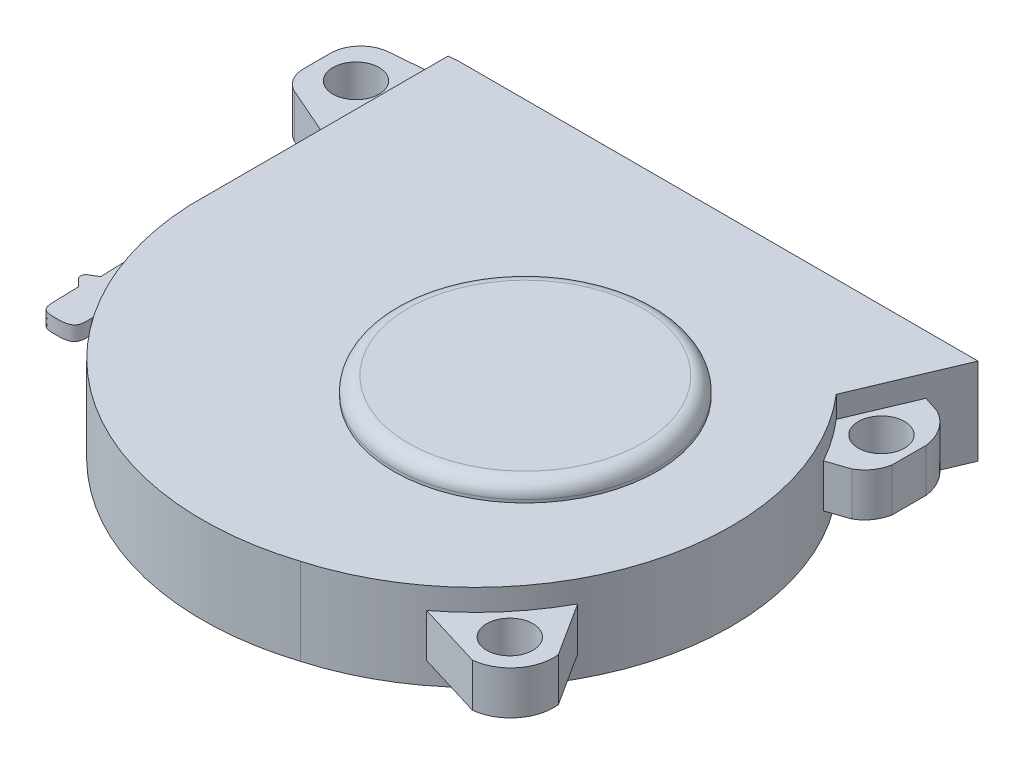
from build123d import *
from build123d.topology import SkipClean

# Parameters (mm, degrees)
SKETCH2_R           = 1.5
BOSS_EXTRUDE1_DEPTH = 3
SKETCH3_R           = 9.096048505
BOSS_EXTRUDE2_DEPTH = 1.2
FILLET1_R           = 1
CUT_EXTRUDE1_DEPTH  = 1.5
CUT_EXTRUDE2_START  = -1.5
CUT_EXTRUDE2_DEPTH  = 1.5
CUT_EXTRUDE3_DEPTH  = 5
MOVE_FACE1_BY       = 0.1
MOVE_FACE1_2_BY     = 0.1
MOVE_FACE1_3_BY     = 0.1


with BuildPart() as part:
    # Sketch2 → Boss-Extrude1 (new, symmetric)
    with BuildSketch(Plane(origin=(0, 0, 0), x_dir=(1, 0, 0), z_dir=(0, 1, 0))):
        with BuildLine():
            Line((-20.599560655, -3.593123858), (-21.028912901, -3.379903546))
            Line((-21.028912901, -3.379903546), (-21.254187526, 1.993220784))
            add(Edge.make_bspline(
                [(-21.254187526, 1.993220784), (-21.250081776, 2.377226096), (-21.195139063, 3.186038357), (-20.237966675, 3.678013728), (-19.626306607, 3.674971934), (-19.293061526, 3.554683236)],
                knots=[0.008573336, 0.008573336, 0.008573336, 0.008573336, 0.425411643, 0.645508579, 0.988655727, 0.988655727, 0.988655727, 0.988655727], degree=3))
            Line((-19.293061526, 3.554683236), (-19.293061526, -0.935875279))
            ThreePointArc((-19.293061526, -0.935875279), (-11.01478007, -15.867347151), (5.868677769, -18.402627716))
            ThreePointArc((5.868677769, -18.402627716), (8.914480471, -17.213611271), (11.689585214, -15.484603502))
            Line((11.689585214, -15.484603502), (16.248961374, -16.876941699))
            ThreePointArc((16.248961374, -16.876941699), (18.257558766, -15.774505508), (18.891422269, -13.572677609))
            Line((18.891422269, -13.572677609), (16.51986009, -9.867884272))
            ThreePointArc((16.51986009, -9.867884272), (18.681381592, -1.319406436), (16.449996012, 7.211101574))
            Line((16.449996012, 7.211101574), (17.928084104, 7.713187831))
            ThreePointArc((17.928084104, 7.713187831), (18.677006581, 8.400562387), (19.066466062, 9.339545863))
            Line((19.066466062, 9.339545863), (19.069212644, 11.701301235))
            ThreePointArc((19.069212644, 11.701301235), (18.53112158, 13.108816633), (17.413375201, 14.119402908))
            Line((17.413375201, 14.119402908), (16.248961374, 14.508827059))
            Line((16.248961374, 14.508827059), (17.314988377, 17.040275234))
            Line((17.314988377, 17.040275234), (-18.629227908, 17.040275234))
            Line((-18.629227908, 17.040275234), (-23.111573489, 16.669208858))
            ThreePointArc((-23.111573489, 16.669208858), (-24.534989581, 15.930034001), (-25.030823978, 14.404700893))
            Line((-25.030823978, 14.404700893), (-25.030823978, 12.70560175))
            ThreePointArc((-25.030823978, 12.70560175), (-24.756748057, 11.739888101), (-24.016241086, 11.062119787))
            Line((-24.016241086, 11.062119787), (-19.293061526, 9.00102042))
            Line((-19.293061526, 9.00102042), (-19.293061526, 5.839179653))
            Line((-19.293061526, 5.839179653), (-22.090684207, 5.839179653))
            ThreePointArc((-22.090684207, 5.839179653), (-22.935760928, 5.565442119), (-23.357392581, 4.783576625))
            Line((-23.357392581, 4.783576625), (-23.096619876, -3.253456456))
            Line((-23.096619876, -3.253456456), (-23.621531964, -3.576891157))
            ThreePointArc((-23.621531964, -3.576891157), (-23.831523214, -3.884927944), (-23.671952518, -4.221855504))
            Line((-23.671952518, -4.221855504), (-23.25143386, -4.644287186))
            Line((-23.25143386, -4.644287186), (-23.202937263, -6.523606801))
            add(Edge.make_bspline(
                [(-23.202937263, -6.523606801), (-23.190415125, -6.701394879), (-23.14585211, -7.158039831), (-22.604610265, -7.291644066), (-22.131088375, -7.301130698), (-21.611573501, -7.301182592), (-20.850084131, -7.060004854), (-20.915185829, -6.352757768), (-20.915665013, -6.081028816)],
                knots=[0, 0, 0, 0, 0.172348306, 0.293808545, 0.415161147, 0.571057182, 0.730620463, 1, 1, 1, 1], degree=3))
            Line((-20.915665013, -6.081028816), (-20.979073646, -4.568641575))
            Line((-20.979073646, -4.568641575), (-20.599560655, -4.155522335))
            ThreePointArc((-20.599560655, -4.155522335), (-20.467265038, -3.874323097), (-20.599560655, -3.593123858))
        make_face()
        with Locations(Location((16.153998691, -14.195749789, 0), (0, 0, 270))):
            Circle(SKETCH2_R, mode=Mode.SUBTRACT)
        with Locations(Location((-22.494848615, 13.810394624, 0), (0, 0, 270))):
            Circle(SKETCH2_R, mode=Mode.SUBTRACT)
        with Locations(Location((16.894563054, 10.777137226, 0), (0, 0, 270))):
            Circle(SKETCH2_R, mode=Mode.SUBTRACT)
    extrude(amount=BOSS_EXTRUDE1_DEPTH, both=True)

    # Sketch3 → Boss-Extrude2 (add)
    with BuildSketch(Plane(origin=(0, 3, 0), x_dir=(1, 0, 0), z_dir=(0, 1, 0))):
        with Locations(Location((3.73137128, -0.69899531, 0), (0, 0, 270))):
            Circle(SKETCH3_R)
    extrude(amount=BOSS_EXTRUDE2_DEPTH)

    # Fillet1
    fillet1_edges = [part.edges().sort_by_distance(p)[0] for p in [
        (3.73137128, 4.2, -8.397053195),
    ]]
    fillet(fillet1_edges, radius=FILLET1_R)

    # Sketch4 → Cut-Extrude1 (cut)
    with SkipClean():  # the faces are left unmerged after this step: merging them gives an invalid solid
        with BuildSketch(Plane(origin=(0, 3, 0), x_dir=(1, 0, 0), z_dir=(0, 1, 0))):
            Polygon((-19.293061526, 7.248655358), (-19.293061526, 22.083159944), (-29.904114882, 22.083159944), (-28.79317924, 8.663465276), align=None)
            with BuildLine():
                Line((17.65280475, 17.842473148), (14.40910217, 10.139793056))
                ThreePointArc((14.40910217, 10.139793056), (16.735981963, 6.675507155), (18.187015276, 2.762688645))
                Line((18.187015276, 2.762688645), (25.347732491, 2.045186791))
                Line((25.347732491, 2.045186791), (30.175625625, 15.043360613))
                Line((30.175625625, 15.043360613), (17.65280475, 17.842473148))
            make_face()
            with BuildLine():
                Line((17.279847396, -8.294754226), (24.575782686, -15.276129443))
                Line((24.575782686, -15.276129443), (17.279847396, -23.8721919))
                Line((17.279847396, -23.8721919), (10.670432719, -16.203678062))
                ThreePointArc((10.670432719, -16.203678062), (14.563628552, -12.741010549), (17.279847396, -8.294754226))
            make_face()
        extrude(amount=-CUT_EXTRUDE1_DEPTH, mode=Mode.SUBTRACT)

    # Sketch5 → Cut-Extrude2 (cut)
    with SkipClean():  # the faces are left unmerged after this step: merging them gives an invalid solid
        with BuildSketch(Plane.XZ.offset(3).offset(CUT_EXTRUDE2_START)):
            with BuildLine():
                Line((14.40910217, -10.139793056), (17.65280475, -17.842473148))
                Line((17.65280475, -17.842473148), (30.175625625, -15.043360613))
                Line((30.175625625, -15.043360613), (25.347732491, -2.045186791))
                Line((25.347732491, -2.045186791), (18.187015276, -2.762688645))
                ThreePointArc((18.187015276, -2.762688645), (16.735981963, -6.675507155), (14.40910217, -10.139793056))
            make_face()
            Polygon((-19.293061526, -22.083159944), (-19.293061526, -7.248655358), (-28.79317924, -8.663465276), (-29.904114882, -22.083159944), align=None)
            with BuildLine():
                Line((24.575782686, 15.276129443), (17.279847396, 23.8721919))
                Line((17.279847396, 23.8721919), (10.670432719, 16.203678062))
                ThreePointArc((10.670432719, 16.203678062), (14.563628552, 12.741010549), (17.279847396, 8.294754226))
                Line((17.279847396, 8.294754226), (24.575782686, 15.276129443))
            make_face()
        extrude(amount=CUT_EXTRUDE2_DEPTH, mode=Mode.SUBTRACT)

    # Sketch6 → Cut-Extrude3 (cut)
    with SkipClean():  # the faces are left unmerged after this step: merging them gives an invalid solid
        with BuildSketch(Plane(origin=(0, 3, 0), x_dir=(1, 0, 0), z_dir=(0, 1, 0))):
            Polygon((-19.293061526, -0.935875279), (-19.293061526, 7.436034842), (-28.419835781, 7.111305906), (-26.742069614, -11.668850866), (-19.293061526, -11.003377521), align=None)
        extrude(amount=-CUT_EXTRUDE3_DEPTH, mode=Mode.SUBTRACT)

    # Move Face1: a curved face moved inward by 0.1
    add(Solid.thicken(part.faces().sort_by_distance((16.153998691, 0, 12.695749789))[0], -MOVE_FACE1_BY), mode=Mode.SUBTRACT)

    # Move Face1 2: a curved face moved inward by 0.1
    add(Solid.thicken(part.faces().sort_by_distance((-22.494848615, 0, -15.310394624))[0], -MOVE_FACE1_2_BY), mode=Mode.SUBTRACT)

    # Move Face1 3: a curved face moved inward by 0.1
    add(Solid.thicken(part.faces().sort_by_distance((16.894563054, 0, -12.277137226))[0], -MOVE_FACE1_3_BY), mode=Mode.SUBTRACT)


solid = part.part
